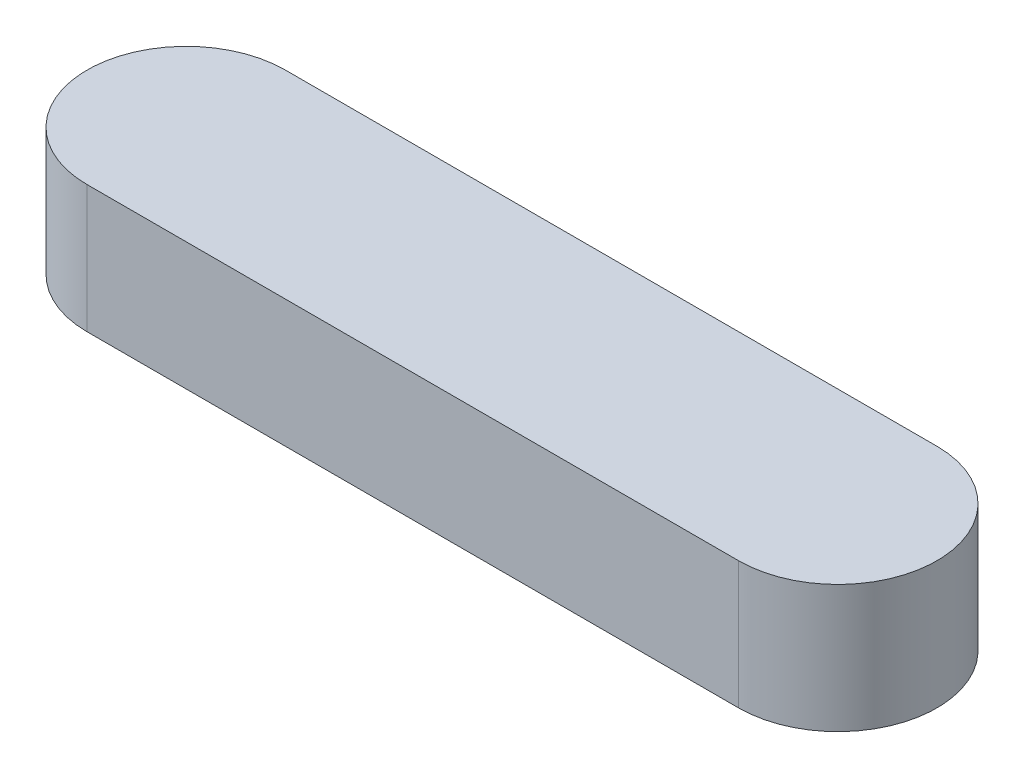
from build123d import *

# Parameters (mm, degrees)
EXTRUDE_1_DEPTH = 9


with BuildPart() as part:
    # Эскиз1 → Бобышка-Вытянуть1 (new body)
    with BuildSketch(Plane(origin=(0, 0, 0), x_dir=(1, 0, 0), z_dir=(0, 1, 0))):
        with BuildLine():
            Line((-23, 7), (23, 7))
            ThreePointArc((23, 7), (30, 0), (23, -7))
            Line((23, -7), (-23, -7))
            ThreePointArc((-23, -7), (-30, 0), (-23, 7))
        make_face()
    extrude(amount=EXTRUDE_1_DEPTH)


solid = part.part
